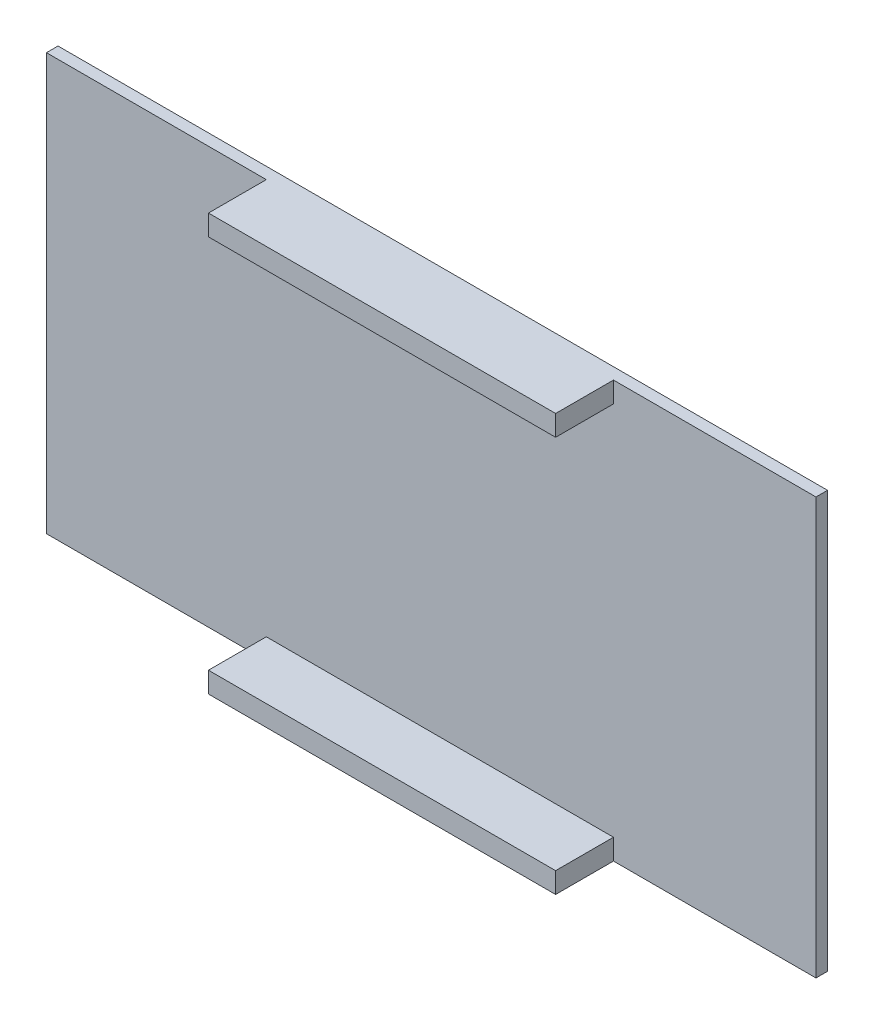
from build123d import *

# Parameters (mm, degrees)
SKETCH1_W           = 133
SKETCH1_H           = 72
BOSS_EXTRUDE1_DEPTH = 2
SKETCH2_W           = 60
SKETCH2_H           = 3.570225369
BOSS_EXTRUDE2_DEPTH = 10


with BuildPart() as part:
    # Sketch1 → Boss-Extrude1 (new body)
    with BuildSketch(Plane.XY):
        Rectangle(SKETCH1_W, SKETCH1_H)
    extrude(amount=BOSS_EXTRUDE1_DEPTH)

    # Sketch2 → Boss-Extrude2 (add)
    with BuildSketch(Plane.XY.offset(2)):
        with Locations((1.5, 34.214887316)):
            Rectangle(SKETCH2_W, SKETCH2_H)
    boss_extrude2 = extrude(amount=BOSS_EXTRUDE2_DEPTH)

    # Mirror1: Boss-Extrude2 across plane
    add(boss_extrude2.mirror(Plane.ZX))


solid = part.part
